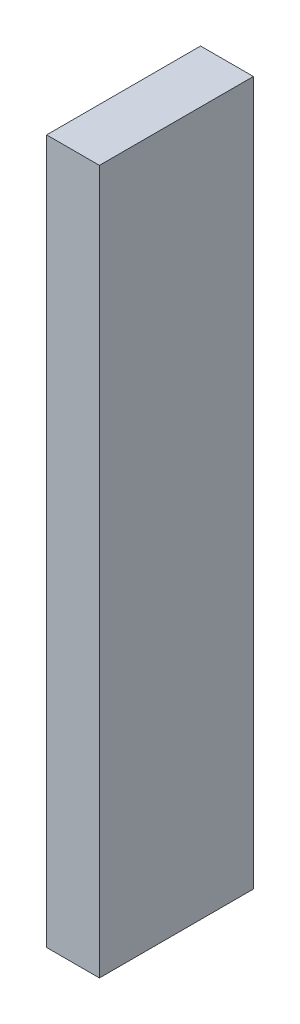
from build123d import *

# Parameters (mm, degrees)
PROFILE_SKETCH_W      = 6
PROFILE_SKETCH_H      = 17.5
PROFILE_EXTRUDE_DEPTH = 80


with BuildPart() as part:
    # Profile Sketch → Profile Extrude (new body)
    with BuildSketch(Plane(origin=(-13.83405858, 0, -105.75669297), x_dir=(-1, 0, 0), z_dir=(0, 1, 0))):
        with Locations((0, 8.75)):
            Rectangle(PROFILE_SKETCH_W, PROFILE_SKETCH_H)
    extrude(amount=PROFILE_EXTRUDE_DEPTH)


solid = part.part
